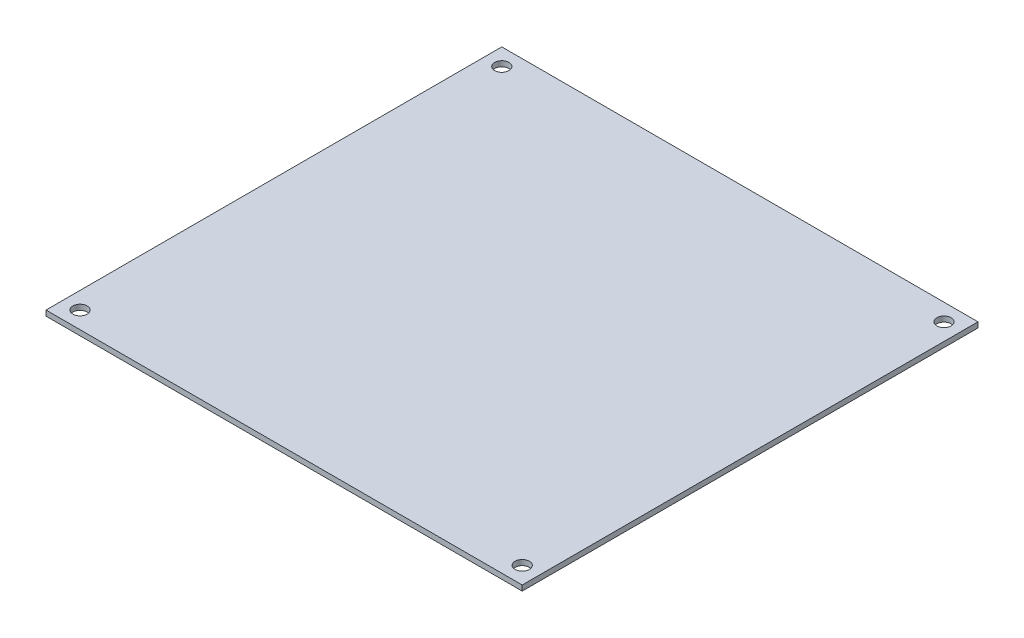
from build123d import *

# Parameters (mm, degrees)
SKETCH1_W           = 140
SKETCH1_H           = 134
SKETCH1_R           = 2.1
BOSS_EXTRUDE1_DEPTH = 1.57


with BuildPart() as part:
    # Sketch1 → Boss-Extrude1 (new body)
    with BuildSketch(Plane(origin=(0, 0, 0), x_dir=(1, 0, 0), z_dir=(0, 1, 0))):
        with Locations((70, 67)):
            Rectangle(SKETCH1_W, SKETCH1_H)
        with Locations(Location((5, 129, 0), (0, 0, 270))):
            Circle(SKETCH1_R, mode=Mode.SUBTRACT)
        with Locations(Location((135, 129, 0), (0, 0, 270))):
            Circle(SKETCH1_R, mode=Mode.SUBTRACT)
        with Locations(Location((135, 5, 0), (0, 0, 270))):
            Circle(SKETCH1_R, mode=Mode.SUBTRACT)
        with Locations(Location((5, 5, 0), (0, 0, 270))):
            Circle(SKETCH1_R, mode=Mode.SUBTRACT)
    extrude(amount=BOSS_EXTRUDE1_DEPTH)


solid = part.part
